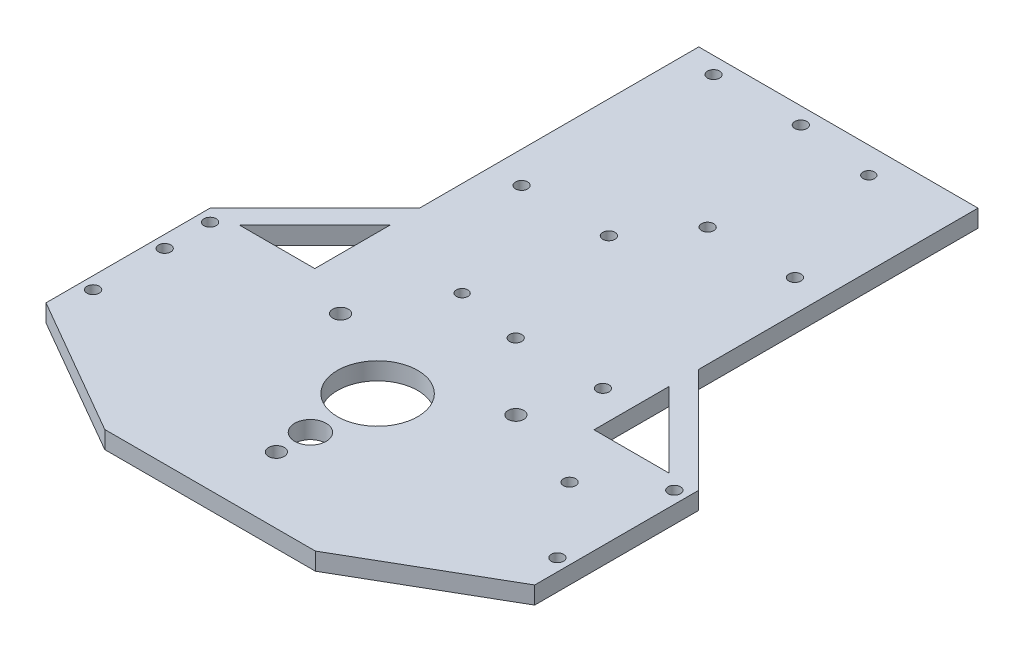
from build123d import *

# Parameters (mm, degrees)
SKETCH_1_W          = 80
SKETCH_1_H          = 180
EXTRUDE_1_DEPTH     = 5
HOLE_WIZARD_1_D     = 3.5
HOLE_WIZARD_2_D     = 4.5
HOLE_WIZARD_3_D     = 23
HOLE_WIZARD_4_D     = 9
SKETCH_13_W         = 30
SKETCH_13_H         = 70
EXTRUDE_2_DEPTH     = 5
EXTRUDE_3_DEPTH     = 5
HOLE_WIZARD_5_D     = 3.5
CUT_EXTRUDE_1_DEPTH = 5
HOLE_WIZARD_6_D     = 3.5
HOLE_WIZARD_7_D     = 3.5
HOLE_WIZARD_8_D     = 3.3
HOLE_WIZARD_9_D     = 3.5


with BuildPart() as part:
    # 草图1 → 凸台-拉伸1 (new body)
    with BuildSketch(Plane(origin=(0, 0, 0), x_dir=(1, 0, 0), z_dir=(0, 1, 0))):
        Rectangle(SKETCH_1_W, SKETCH_1_H)
    extrude(amount=EXTRUDE_1_DEPTH)

    # 孔1 (through all)
    with Locations(Plane(origin=(0, 5, 0), x_dir=(1, 0, 0), z_dir=(0, 1, 0))):
        with Locations((-31, 85.25), (-6, 85.25), (-6, 30.25), (-31, 30.25), (6, -8.45), (6, 46.55), (31, 46.55), (31, -8.45)):
            Hole(HOLE_WIZARD_1_D / 2)

    # 孔2 (through all)
    with Locations(Plane(origin=(0, 5, 0), x_dir=(1, 0, 0), z_dir=(0, 1, 0))):
        with Locations((0, -71), (25.11473671, -27.5), (-25.11473671, -27.5)):
            Hole(HOLE_WIZARD_2_D / 2)

    # 孔3 (through all)
    with Locations(Plane(origin=(0, 5, 0), x_dir=(1, 0, 0), z_dir=(0, 1, 0))):
        with Locations((0, -42)):
            Hole(HOLE_WIZARD_3_D / 2)

    # 孔4 (through all)
    with Locations(Plane(origin=(0, 5, 0), x_dir=(1, 0, 0), z_dir=(0, 1, 0))):
        with Locations((0, -61.25)):
            Hole(HOLE_WIZARD_4_D / 2)

    # 草图13 → 凸台-拉伸2 (add)
    with BuildSketch(Plane(origin=(0, 5, 0), x_dir=(1, 0, 0), z_dir=(0, 1, 0))):
        with Locations((-55, -55)):
            Rectangle(SKETCH_13_W, SKETCH_13_H)
        with Locations((55, -55)):
            Rectangle(SKETCH_13_W, SKETCH_13_H)
    extrude(amount=-EXTRUDE_2_DEPTH)

    # 草图15 → 凸台-拉伸3 (add)
    with BuildSketch(Plane(origin=(0, 5, 0), x_dir=(1, 0, 0), z_dir=(0, 1, 0))):
        Polygon((-40, 10), (-70, -20), (-61.514718626, -20), (-40, 1.514718626), align=None)
        Polygon((61.514718626, -20), (70, -20), (40, 10), (40, 1.514718626), align=None)
    extrude(amount=-EXTRUDE_3_DEPTH)

    # 孔5 (through all)
    with Locations(Plane(origin=(0, 5, 0), x_dir=(1, 0, 0), z_dir=(0, 1, 0))):
        with Locations((-66.5, -57), (66.5, -57)):
            Hole(HOLE_WIZARD_5_D / 2)

    # 草图19 → 切除-拉伸1 (cut)
    with BuildSketch(Plane(origin=(0, 5, 0), x_dir=(1, 0, 0), z_dir=(0, 1, 0))):
        Polygon((-70, -67), (-30.162831426, -90), (-70, -90), align=None)
        Polygon((30.162831426, -90), (70, -67), (70, -90), align=None)
    extrude(amount=-CUT_EXTRUDE_1_DEPTH, mode=Mode.SUBTRACT)

    # 孔6 (through all)
    with Locations(Plane(origin=(0, 5, 0), x_dir=(1, 0, 0), z_dir=(0, 1, 0))):
        with Locations((-66.5, -23.5), (66.5, -23.5)):
            Hole(HOLE_WIZARD_6_D / 2)

    # 孔7 (through all)
    with Locations(Plane(origin=(0, 5, 0), x_dir=(1, 0, 0), z_dir=(0, 1, 0))):
        with Locations((49.5, -36.5)):
            Hole(HOLE_WIZARD_7_D / 2)

    # 孔8 (through all)
    with Locations(Plane(origin=(0, 5, 0), x_dir=(1, 0, 0), z_dir=(0, 1, 0))):
        with Locations((-12.784, -5), (16.216, 82.5)):
            Hole(HOLE_WIZARD_8_D / 2)

    # 孔9 (through all)
    with Locations(Plane(origin=(0, 5, 0), x_dir=(1, 0, 0), z_dir=(0, 1, 0))):
        with Locations((-66.5, -36.5)):
            Hole(HOLE_WIZARD_9_D / 2)


solid = part.part
